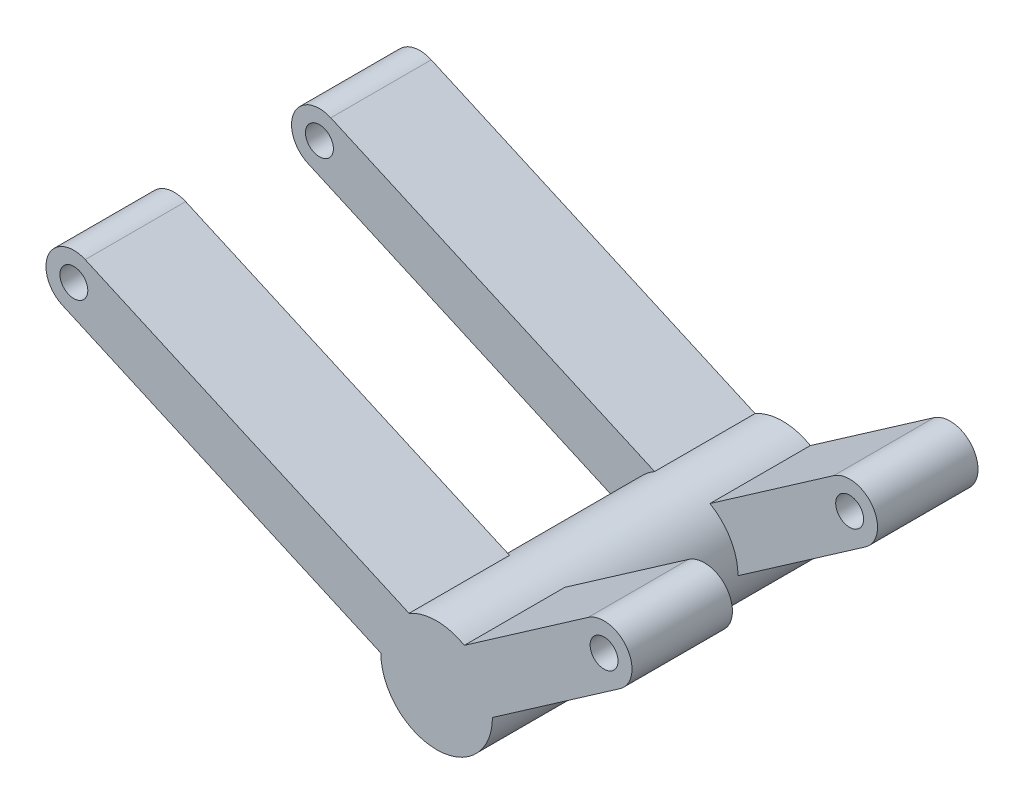
from build123d import *
from build123d.topology import SkipClean

# Parameters (mm, degrees)
SKETCH1_R           = 5
BOSS_EXTRUDE3_DEPTH = 6.5
BOSS_EXTRUDE4_START = 9
SKETCH3_R           = 1.25
SKETCH3_R_2         = 5
BOSS_EXTRUDE4_DEPTH = 9


with BuildPart() as part:
    # Sketch1 → Boss-Extrude3 (new, symmetric)
    with BuildSketch(Plane.XY):
        with Locations(Location((0, 0, 0), (0, 0, 180))):
            Circle(SKETCH1_R)
    extrude(amount=BOSS_EXTRUDE3_DEPTH, both=True)

    # Sketch3 → Boss-Extrude4 (add)
    # profile 1 of 3: a face of its own
    with BuildSketch(Plane.XY.offset(6.5).offset(BOSS_EXTRUDE4_START)):
        with BuildLine():
            ThreePointArc((2.483058563, 4.339864073), (4.325233682, 2.508456416), (5, 0))
            Line((5, 0), (16.427426363, 7.947573637))
            ThreePointArc((16.427426363, 7.947573637), (17.052426363, 11.427426363), (13.572573637, 12.052426363))
            Line((13.572573637, 12.052426363), (2.483058563, 4.339864073))
        make_face()
        with Locations((15, 10)):
            Circle(SKETCH3_R, mode=Mode.SUBTRACT)
    # profile 2 of 3: a face of its own
    with BuildSketch(Plane.XY.offset(6.5).offset(BOSS_EXTRUDE4_START)):
        with BuildLine():
            Line((-33.518152484, 12.716720446), (-5, 0))
            ThreePointArc((-5, 0), (-4.321713979, 2.514515517), (-2.470884686, 4.346806744))
            Line((-2.470884686, 4.346806744), (-31.481847516, 17.283279554))
            ThreePointArc((-31.481847516, 17.283279554), (-34.783279554, 16.018152484), (-33.518152484, 12.716720446))
        make_face()
        with Locations((-32.5, 15)):
            Circle(SKETCH3_R, mode=Mode.SUBTRACT)
    # profile 3 of 3: a face of its own
    with BuildSketch(Plane.XY.offset(6.5).offset(BOSS_EXTRUDE4_START)):
        Circle(SKETCH3_R_2)
    boss_extrude4 = extrude(amount=-BOSS_EXTRUDE4_DEPTH)

    # Mirror12: Boss-Extrude4 across plane
    with SkipClean():  # the faces are left unmerged after this step: merging them gives an invalid solid
        add(boss_extrude4.mirror(Plane.XY))


solid = part.part
